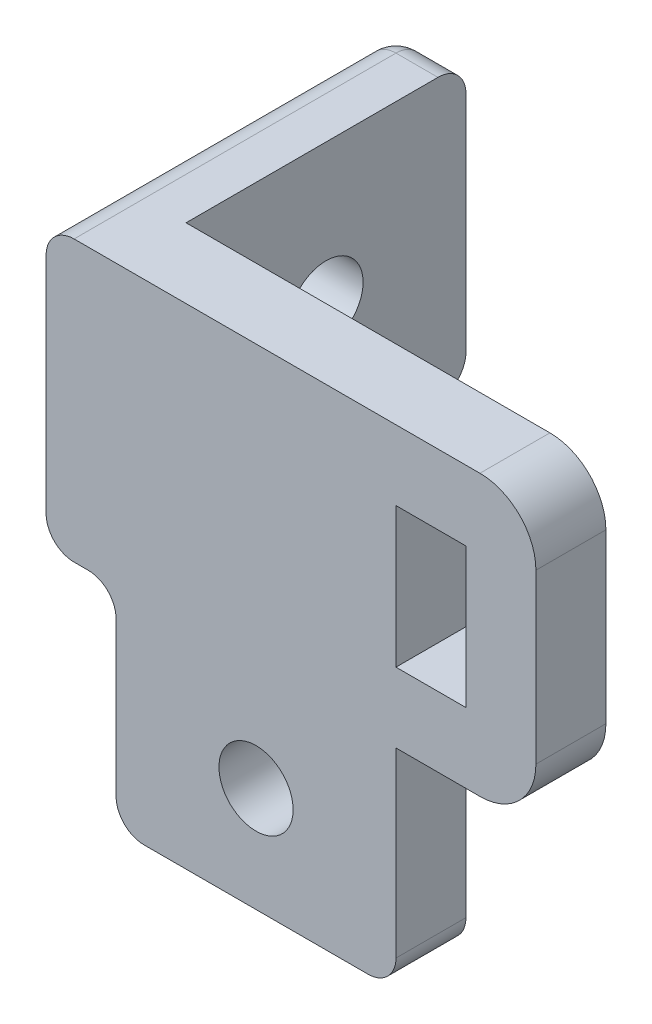
from build123d import *

# Parameters (mm, degrees)
CROQUIS1_W              = 5
CROQUIS1_H              = 10
SALIENTE_EXTRUIR1_DEPTH = 5
CROQUIS2_W              = 5
CROQUIS2_H              = 20
SALIENTE_EXTRUIR3_DEPTH = 25
CROQUIS3_R              = 2.65
CORTAR_EXTRUIR1_DEPTH   = 42.533119315
CROQUIS4_W              = 20
CROQUIS4_H              = 15
CROQUIS4_R              = 2.65
SALIENTE_EXTRUIR4_DEPTH = 5
REDONDEO1_R             = 2
REDONDEO2_R             = 2
REDONDEO3_R             = 2
REDONDEO4_R             = 2


with BuildPart() as part:
    # Croquis1 → Saliente-Extruir1 (new body)
    with BuildSketch(Plane.XY):
        with BuildLine():
            Line((-15, 10), (-15, -10))
            Line((-15, -10), (11, -10))
            ThreePointArc((11, -10), (13.828427125, -8.828427125), (15, -6))
            Line((15, -6), (15, 6))
            ThreePointArc((15, 6), (13.828427125, 8.828427125), (11, 10))
            Line((11, 10), (-15, 10))
        make_face()
        with Locations((7.5, 0)):
            Rectangle(CROQUIS1_W, CROQUIS1_H, mode=Mode.SUBTRACT)
    extrude(amount=SALIENTE_EXTRUIR1_DEPTH)

    # Croquis2 → Saliente-Extruir3 (add)
    with BuildSketch(Plane.XY.offset(5)):
        with Locations((-17.5, 0)):
            Rectangle(CROQUIS2_W, CROQUIS2_H)
    extrude(amount=-SALIENTE_EXTRUIR3_DEPTH)

    # Croquis3 → Cortar-Extruir1 (cut, through all)
    with BuildSketch(Plane.ZY.offset(20)):
        with Locations((-10, 0)):
            Circle(CROQUIS3_R)
    extrude(amount=-CORTAR_EXTRUIR1_DEPTH, mode=Mode.SUBTRACT)

    # Croquis4 → Saliente-Extruir4 (add)
    with BuildSketch(Plane.XY.offset(5)):
        with Locations((-5, -17.5)):
            Rectangle(CROQUIS4_W, CROQUIS4_H)
        with Locations((-5, -17.5)):
            Circle(CROQUIS4_R, mode=Mode.SUBTRACT)
    extrude(amount=-SALIENTE_EXTRUIR4_DEPTH)

    # Redondeo1
    redondeo1_edges = [part.edges().sort_by_distance(p)[0] for p in [
        (-15, -10, 2.5),
    ]]
    fillet(redondeo1_edges, radius=REDONDEO1_R)

    # Redondeo2
    redondeo2_edges = [part.edges().sort_by_distance(p)[0] for p in [
        (5, -25, 2.5),
        (-15, -25, 2.5),
    ]]
    fillet(redondeo2_edges, radius=REDONDEO2_R)

    # Redondeo3
    redondeo3_edges = [part.edges().sort_by_distance(p)[0] for p in [
        (-17.5, 10, -20),
        (-17.5, -10, -20),
    ]]
    fillet(redondeo3_edges, radius=REDONDEO3_R)

    # Redondeo4
    redondeo4_edges = [part.edges().sort_by_distance(p)[0] for p in [
        (-20, -10, -6.5),
        (-20, -9.414213562, -19.414213562),
        (-20, 0, -20),
        (-20, 9.414213562, -19.414213562),
        (-20, 10, -6.5),
    ]]
    fillet(redondeo4_edges, radius=REDONDEO4_R)


solid = part.part
